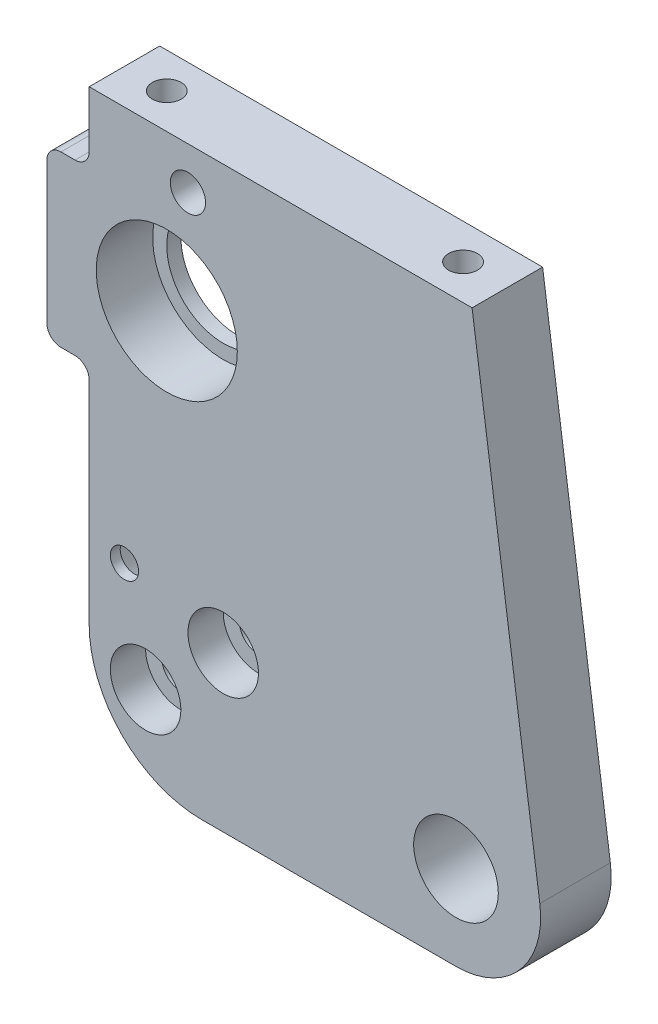
from build123d import *

# Parameters (mm, degrees)
SKETCH_1_W                                           = 34
SKETCH_1_H                                           = 41
EXTRUDE_1_DEPTH                                      = 5
FILLET_1_R                                           = 8
SKETCH_2_R                                           = 3
CUT_EXTRUDE_2_DEPTH                                  = 5
SKETCH_3_R                                           = 4
CUT_EXTRUDE_3_DEPTH                                  = 5
SKETCH_4_R                                           = 5
CUT_EXTRUDE_4_DEPTH                                  = 4
HOLE_WIZARD_M2_5_1_D                                 = 2.05
HOLE_WIZARD_M2_5_1_DEPTH                             = 7.35
HOLE_WIZARD_M2_5_1_TIP                               = 0.615882135
CUT_EXTRUDE_5_DEPTH                                  = 5
EXTRUDE1_DEPTH                                       = 5
SKETCH_8_R                                           = 1
CUT_EXTRUDE_6_DEPTH                                  = 5
CUT_EXTRUDE_7_DEPTH                                  = 2.5
SKETCH_10_R                                          = 3
CUT_EXTRUDE_8_DEPTH                                  = 1.8
CBORE_FOR_M2_5_HEXAGON_SOCKET_HEAD_CAP_S_D           = 2.7
CBORE_FOR_M2_5_HEXAGON_SOCKET_HEAD_CAP_S_CBORE_D     = 5
CBORE_FOR_M2_5_HEXAGON_SOCKET_HEAD_CAP_S_CBORE_DEPTH = 2.5
CBORE_FOR_M2_5_HEXAGON_SOCKET_HEAD_C_2_D             = 2.7
CBORE_FOR_M2_5_HEXAGON_SOCKET_HEAD_C_2_CBORE_D       = 5
CBORE_FOR_M2_5_HEXAGON_SOCKET_HEAD_C_2_CBORE_DEPTH   = 2.5
SKETCH_20_W                                          = 5
SKETCH_20_H                                          = 12
EXTRUDE_1_2_DEPTH                                    = 3
FILLET_2_R                                           = 1
M3X0_5_1_D                                           = 2.5
M3X0_5_1_CSINK_D                                     = 3.05
M3X0_5_1_CSINK_ANGLE                                 = 90


with BuildPart() as part:
    # 草图1 → Extrude 1 (new body)
    with BuildSketch(Plane.XY):
        with Locations((17, -20.5)):
            Rectangle(SKETCH_1_W, SKETCH_1_H)
    extrude(amount=EXTRUDE_1_DEPTH)

    # 圆角1
    fillet_1_edges = [part.edges().sort_by_distance(p)[0] for p in [
        (0, -41, 2.5),
    ]]
    fillet(fillet_1_edges, radius=FILLET_1_R)

    # 草图2 → 拉伸2 (cut)
    with BuildSketch(Plane.XY.offset(5)):
        with Locations((26, -35)):
            Circle(SKETCH_2_R)
    extrude(amount=-CUT_EXTRUDE_2_DEPTH, mode=Mode.SUBTRACT)

    # 草图3 → 拉伸3 (cut)
    with BuildSketch(Plane.XY.offset(5)):
        with Locations((5.5, -11)):
            Circle(SKETCH_3_R)
    extrude(amount=-CUT_EXTRUDE_3_DEPTH, mode=Mode.SUBTRACT)

    # 草图4 → 拉伸4 (cut)
    with BuildSketch(Plane.XY.offset(5)):
        with Locations((5.5, -11)):
            Circle(SKETCH_4_R)
    extrude(amount=-CUT_EXTRUDE_4_DEPTH, mode=Mode.SUBTRACT)

    # M2.5 螺纹孔1
    with Locations(Plane(origin=(3, 0, 2.5), x_dir=(0, 0, 1), z_dir=(0, 1, 0))):
        with Locations((0, 0), (0, 21)):
            Hole(HOLE_WIZARD_M2_5_1_D / 2, depth=HOLE_WIZARD_M2_5_1_DEPTH)
            with Locations((0, 0, -(HOLE_WIZARD_M2_5_1_DEPTH + HOLE_WIZARD_M2_5_1_TIP / 2))):  # 118° drill point
                Cone(0, HOLE_WIZARD_M2_5_1_D / 2, HOLE_WIZARD_M2_5_1_TIP, mode=Mode.SUBTRACT)

    # 草图7 → 拉伸5 (cut)
    with BuildSketch(Plane(origin=(0, 0, 0), x_dir=(-1, 0, 0), z_dir=(0, 0, -1))):
        with BuildLine():
            Line((-31.941608412, -34.164961394), (-27.140036221, 0))
            Line((-27.140036221, 0), (-34, 0))
            Line((-34, 0), (-34, -41))
            Line((-34, -41), (-26, -41))
            ThreePointArc((-26, -41), (-30.528257481, -38.936354174), (-31.941608412, -34.164961394))
        make_face()
    extrude(amount=-CUT_EXTRUDE_5_DEPTH, mode=Mode.SUBTRACT)

    # Sketch1 → Extrude1 (add)
    with BuildSketch(Plane(origin=(0, 0, 0), x_dir=(-1, 0, 0), z_dir=(0, 0, -1))):
        with BuildLine():
            Line((-26, -41), (-12, -41))
            ThreePointArc((-12, -41), (-3.514718626, -37.485281374), (0, -29))
            Line((0, -29), (0, -28.019790857))
            Line((0, -28.019790857), (-29.441458618, -39.914912266))
            ThreePointArc((-29.441458618, -39.914912266), (-27.804234797, -40.722301704), (-26, -41))
        make_face()
    extrude(amount=-EXTRUDE1_DEPTH)

    # 草图8 → 拉伸6 (cut)
    with BuildSketch(Plane(origin=(0, 0, 0), x_dir=(-1, 0, 0), z_dir=(0, 0, -1))):
        with Locations((-2.5, -28)):
            Circle(SKETCH_8_R)
    extrude(amount=-CUT_EXTRUDE_6_DEPTH, mode=Mode.SUBTRACT)

    # 草图9 → 拉伸7 (cut)
    with BuildSketch(Plane(origin=(0, 0, 0), x_dir=(-1, 0, 0), z_dir=(0, 0, -1))):
        with BuildLine():
            Line((-0.761170966, -30.758620396), (-4.707879973, -32.195104998))
            ThreePointArc((-4.707879973, -32.195104998), (-5.472518378, -32.161720164), (-5.989592737, -31.59743252))
            Line((-5.989592737, -31.59743252), (-8.452137769, -24.831645651))
            ThreePointArc((-8.452137769, -24.831645651), (-8.418752936, -24.067007246), (-7.854465292, -23.549932887))
            Line((-7.854465292, -23.549932887), (-3.907756285, -22.113448285))
            ThreePointArc((-3.907756285, -22.113448285), (-3.14311788, -22.146833118), (-2.626043521, -22.711120762))
            Line((-2.626043521, -22.711120762), (-0.163498489, -29.476907632))
            ThreePointArc((-0.163498489, -29.476907632), (-0.196883322, -30.241546037), (-0.761170966, -30.758620396))
        make_face()
    extrude(amount=-CUT_EXTRUDE_7_DEPTH, mode=Mode.SUBTRACT)

    # 草图10 → 拉伸8 (cut)
    with BuildSketch(Plane(origin=(0, 0, 2.5), x_dir=(-1, 0, 0), z_dir=(0, 0, -1))):
        with Locations((-4, -28)):
            Circle(SKETCH_10_R)
    extrude(amount=-CUT_EXTRUDE_8_DEPTH, mode=Mode.SUBTRACT)

    # CBORE for M2.5 Hexagon socket head cap s (through all)
    with Locations(Plane(origin=(4, -35, 5), x_dir=(1, 0, 0), z_dir=(0, 0, 1))):
        with Locations((0, 0)):
            CounterBoreHole(CBORE_FOR_M2_5_HEXAGON_SOCKET_HEAD_CAP_S_D / 2, CBORE_FOR_M2_5_HEXAGON_SOCKET_HEAD_CAP_S_CBORE_D / 2, CBORE_FOR_M2_5_HEXAGON_SOCKET_HEAD_CAP_S_CBORE_DEPTH)

    # CBORE for M2.5 Hexagon socket head c 2 (through all)
    with Locations(Plane(origin=(9.5, -30, 5), x_dir=(1, 0, 0), z_dir=(0, 0, 1))):
        with Locations((0, 0)):
            CounterBoreHole(CBORE_FOR_M2_5_HEXAGON_SOCKET_HEAD_C_2_D / 2, CBORE_FOR_M2_5_HEXAGON_SOCKET_HEAD_C_2_CBORE_D / 2, CBORE_FOR_M2_5_HEXAGON_SOCKET_HEAD_C_2_CBORE_DEPTH)

    # 草图20 → Extrude 1 2 (add)
    with BuildSketch(Plane.ZY):
        with Locations((2.5, -11)):
            Rectangle(SKETCH_20_W, SKETCH_20_H)
    extrude(amount=EXTRUDE_1_2_DEPTH)

    # 圆角2
    fillet_2_edges = [part.edges().sort_by_distance(p)[0] for p in [
        (0, -17, 2.5),
        (0, -5, 2.5),
        (-3, -17, 2.5),
        (-3, -5, 2.5),
    ]]
    fillet(fillet_2_edges, radius=FILLET_2_R)

    # M3x0.5 螺纹孔1 (through all)
    with Locations(Plane(origin=(7, -3, 0), x_dir=(-1, 0, 0), z_dir=(0, 0, -1))):
        with Locations((0, 0)):
            CounterSinkHole(M3X0_5_1_D / 2, M3X0_5_1_CSINK_D / 2, counter_sink_angle=M3X0_5_1_CSINK_ANGLE)


solid = part.part
